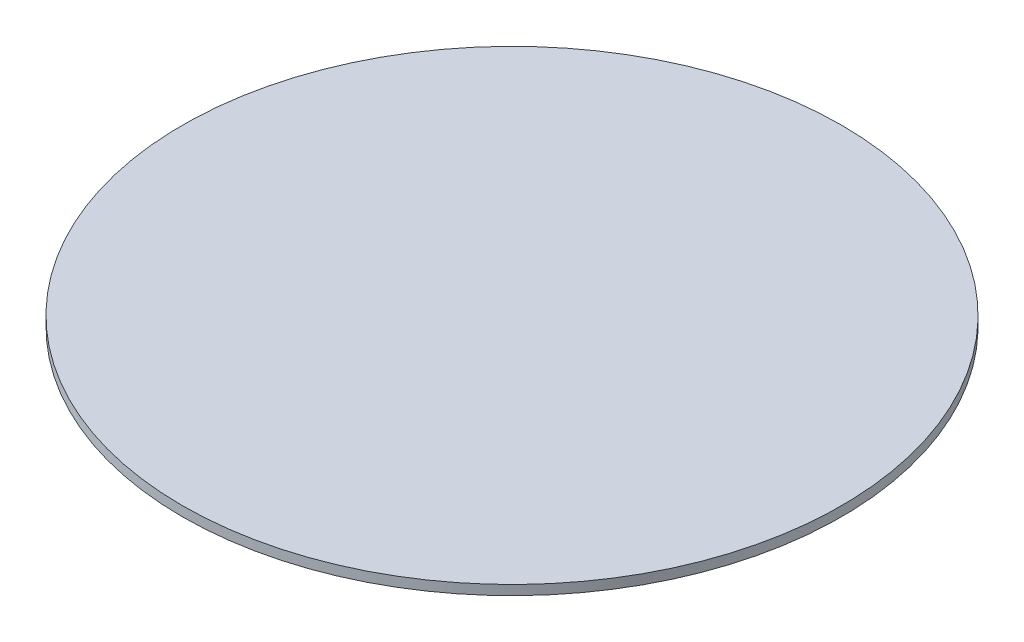
from build123d import *

# Parameters (mm, degrees)
SKETCH1_R           = 19.1
BOSS_EXTRUDE1_DEPTH = 0.560547


with BuildPart() as part:
    # Sketch1 → Boss-Extrude1 (new body)
    with BuildSketch(Plane(origin=(0, 0, 0), x_dir=(1, 0, 0), z_dir=(0, 1, 0))):
        with Locations(Location((0, 0, 0), (0, 0, 270))):
            Circle(SKETCH1_R)
    extrude(amount=BOSS_EXTRUDE1_DEPTH)


solid = part.part
